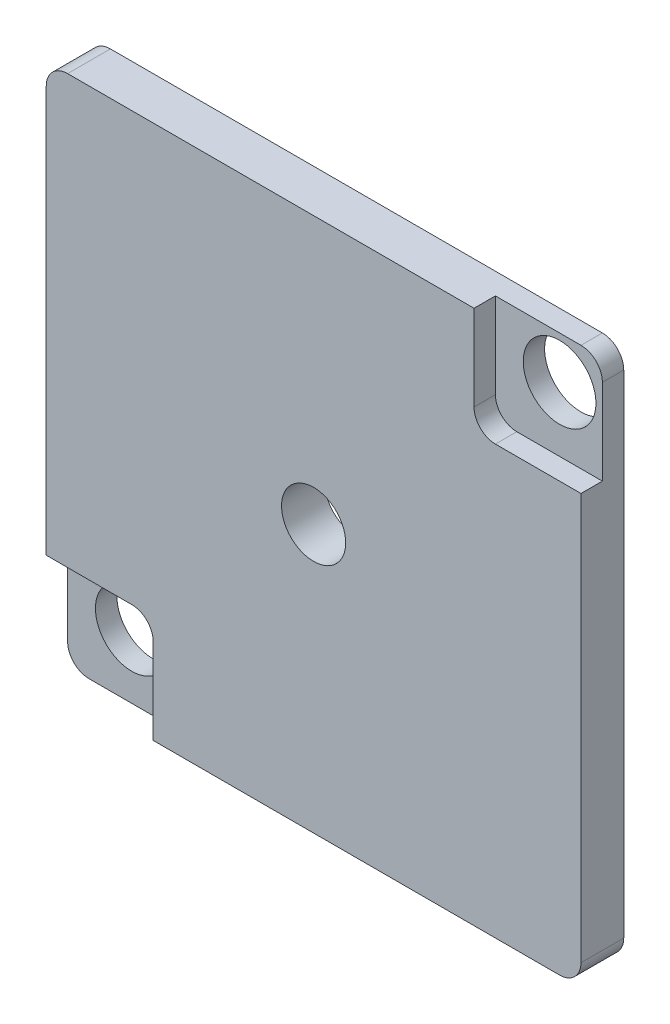
from build123d import *

# Parameters (mm, degrees)
SKETCH1_W            = 25
SKETCH1_H            = 25
BOSS_EXTRUDE1_DEPTH  = 1
BOSS_EXTRUDE2_DEPTH  = 2
FILLET1_R            = 1
SKETCH2_R            = 1.5
CUT_EXTRUDE1_DEPTH   = 18.790446875
M3_CLEARANCE_HOLE1_D = 3.4


with BuildPart() as part:
    # Sketch1 → Boss-Extrude1 (new body)
    with BuildSketch(Plane.XY):
        Rectangle(SKETCH1_W, SKETCH1_H)
    extrude(amount=BOSS_EXTRUDE1_DEPTH)

    # Sketch1<3> → Boss-Extrude2 (add)
    with BuildSketch(Plane.XY):
        with BuildLine():
            Line((7.5, 8.5), (7.5, 12.5))
            Line((7.5, 12.5), (-12.5, 12.5))
            Line((-12.5, 12.5), (-12.5, -7.5))
            Line((-12.5, -7.5), (-8.5, -7.5))
            ThreePointArc((-8.5, -7.5), (-7.792893219, -7.792893219), (-7.5, -8.5))
            Line((-7.5, -8.5), (-7.5, -12.5))
            Line((-7.5, -12.5), (12.5, -12.5))
            Line((12.5, -12.5), (12.5, 7.5))
            Line((12.5, 7.5), (8.5, 7.5))
            ThreePointArc((8.5, 7.5), (7.792893219, 7.792893219), (7.5, 8.5))
        make_face()
    extrude(amount=BOSS_EXTRUDE2_DEPTH)

    # Fillet1
    fillet1_edges = [part.edges().sort_by_distance(p)[0] for p in [
        (12.5, -12.5, 1),
        (-12.5, -12.5, 0.5),
        (-12.5, 12.5, 1),
        (12.5, 12.5, 0.5),
    ]]
    fillet(fillet1_edges, radius=FILLET1_R)

    # Sketch2 → Cut-Extrude1 (cut, through all)
    with BuildSketch(Plane.XY.offset(2)):
        Circle(SKETCH2_R)
    extrude(amount=-CUT_EXTRUDE1_DEPTH, mode=Mode.SUBTRACT)

    # M3 Clearance Hole1 (through all)
    with Locations(Plane.XY.offset(1)):
        with Locations((10.5, 10.5), (-9.5, -9.5)):
            Hole(M3_CLEARANCE_HOLE1_D / 2)


solid = part.part
